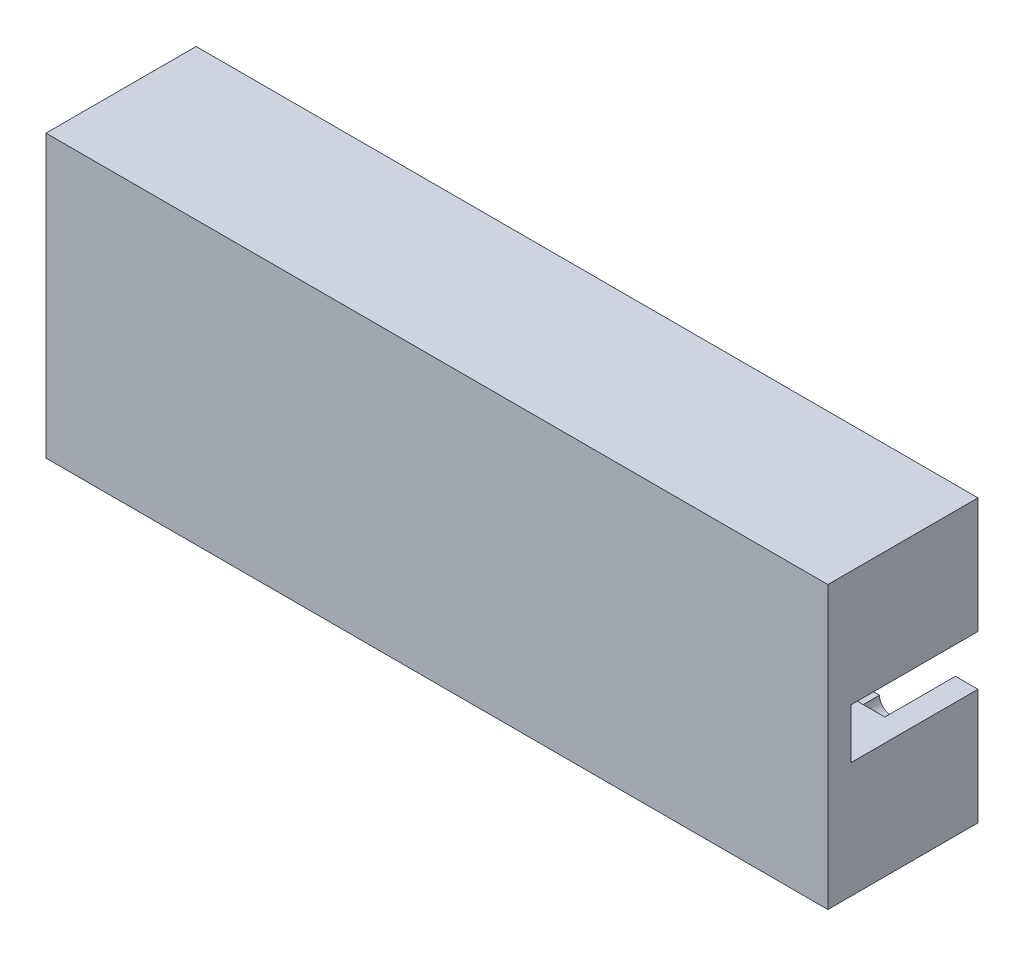
from build123d import *

# Parameters (mm, degrees)
SKETCH1_W           = 158.75
SKETCH1_H           = 57.15
BOSS_EXTRUDE1_DEPTH = 29.591
SKETCH2_W           = 132.588
SKETCH2_H           = 32.258
CUT_EXTRUDE1_DEPTH  = 90.401054418
CUT_EXTRUDE2_DEPTH  = 14.351
FILLET1_R           = 2.38125
SKETCH8_W           = 15.24
SKETCH8_H           = 10.16
CUT_EXTRUDE5_DEPTH  = 25.781
SKETCH5_W           = 158.75
SKETCH5_H           = 57.15
BOSS_EXTRUDE2_DEPTH = 0.889
CUT_EXTRUDE3_REACH  = 91.699
SKETCH7_R           = 20
CUT_EXTRUDE4_DEPTH  = 5


with BuildPart() as part:
    # Sketch1 → Boss-Extrude1 (new body)
    with BuildSketch(Plane.XY):
        Rectangle(SKETCH1_W, SKETCH1_H)
    extrude(amount=BOSS_EXTRUDE1_DEPTH)

    # Sketch2 → Cut-Extrude1 (cut, through all)
    with BuildSketch(Plane(origin=(0, 0, 0), x_dir=(-1, 0, 0), z_dir=(0, 0, -1))):
        with Locations((2.159, 0)):
            Rectangle(SKETCH2_W, SKETCH2_H)
    extrude(amount=-CUT_EXTRUDE1_DEPTH, mode=Mode.SUBTRACT)

    # Sketch4 → Cut-Extrude2 (cut)
    with BuildSketch(Plane(origin=(0, 0, 0), x_dir=(-1, 0, 0), z_dir=(0, 0, -1))):
        Polygon((-74.803, 5.08), (-89.535, 5.08), (-89.535, 3.5), (-79.375, 3.5), (-79.375, 0), (-64.135, 0), (-64.135, 5.08), (-64.135, 16.129), (-74.803, 16.129), align=None)
    cut_extrude2 = extrude(amount=-CUT_EXTRUDE2_DEPTH, mode=Mode.SUBTRACT)

    # Mirror1: Cut-Extrude2 across plane
    add(cut_extrude2.mirror(Plane.ZX), mode=Mode.SUBTRACT)

    # Fillet1
    fillet1_edges = [part.edges().sort_by_distance(p)[0] for p in [
        (74.803, 16.129, 7.1755),
        (74.803, -16.129, 7.1755),
    ]]
    fillet(fillet1_edges, radius=FILLET1_R)

    # Sketch8 → Cut-Extrude5 (cut)
    with BuildSketch(Plane(origin=(0, 0, 0), x_dir=(-1, 0, 0), z_dir=(0, 0, -1))):
        with Locations((-71.755, 0)):
            Rectangle(SKETCH8_W, SKETCH8_H)
    extrude(amount=-CUT_EXTRUDE5_DEPTH, mode=Mode.SUBTRACT)

    # Sketch5 → Boss-Extrude2 (add)
    with BuildSketch(Plane.XY.offset(29.591)):
        Rectangle(SKETCH5_W, SKETCH5_H)
    extrude(amount=BOSS_EXTRUDE2_DEPTH)

    # Cut-Extrude3: up to this face of the body (flat: up to its plane)
    cut_extrude3_end = Plane(part.part.faces().sort_by_distance((-2.159, 0, 29.591))[0])
    # Sketch6 → Cut-Extrude3 (cut, up to the picked face)
    with BuildSketch(Plane(origin=(0, 0, 0), x_dir=(-1, 0, 0), z_dir=(0, 0, -1)), mode=Mode.PRIVATE) as cut_extrude3_sk1:
        with BuildLine():
            Line((-64.135, -16.129), (-64.135, 16.129))
            ThreePointArc((-64.135, 16.129), (-61.75375, 18.51025), (-59.3725, 16.129))
            Line((-59.3725, 16.129), (-59.3725, -16.129))
            ThreePointArc((-59.3725, -16.129), (-61.75375, -18.51025), (-64.135, -16.129))
        make_face()
    cut_extrude3_tool1 = split(extrude(cut_extrude3_sk1.sketch, amount=-CUT_EXTRUDE3_REACH, mode=Mode.PRIVATE), bisect_by=cut_extrude3_end, keep=Keep.BOTH, mode=Mode.PRIVATE)
    # Sketch6 → Cut-Extrude3 (cut, up to the picked face)
    with BuildSketch(Plane(origin=(0, 0, 0), x_dir=(-1, 0, 0), z_dir=(0, 0, -1)), mode=Mode.PRIVATE) as cut_extrude3_sk2:
        with BuildLine():
            Line((68.453, -16.129), (68.453, 16.129))
            ThreePointArc((68.453, 16.129), (66.07175, 18.51025), (63.6905, 16.129))
            Line((63.6905, 16.129), (63.6905, -16.129))
            ThreePointArc((63.6905, -16.129), (66.07175, -18.51025), (68.453, -16.129))
        make_face()
    cut_extrude3_tool2 = split(extrude(cut_extrude3_sk2.sketch, amount=-CUT_EXTRUDE3_REACH, mode=Mode.PRIVATE), bisect_by=cut_extrude3_end, keep=Keep.BOTH, mode=Mode.PRIVATE)
    add(cut_extrude3_tool1.solids().sort_by(Axis((61.75375, 0, 0), (0, 0, 1)))[0], mode=Mode.SUBTRACT)
    add(cut_extrude3_tool2.solids().sort_by(Axis((-66.07175, 0, 0), (0, 0, 1)))[0], mode=Mode.SUBTRACT)

    # Sketch7 → Cut-Extrude4 (cut)
    with BuildSketch(Plane(origin=(0, 0, 0), x_dir=(-1, 0, 0), z_dir=(0, 0, -1))):
        with Locations((31.75, 0)):
            Circle(SKETCH7_R)
    extrude(amount=-CUT_EXTRUDE4_DEPTH, mode=Mode.SUBTRACT)


solid = part.part
